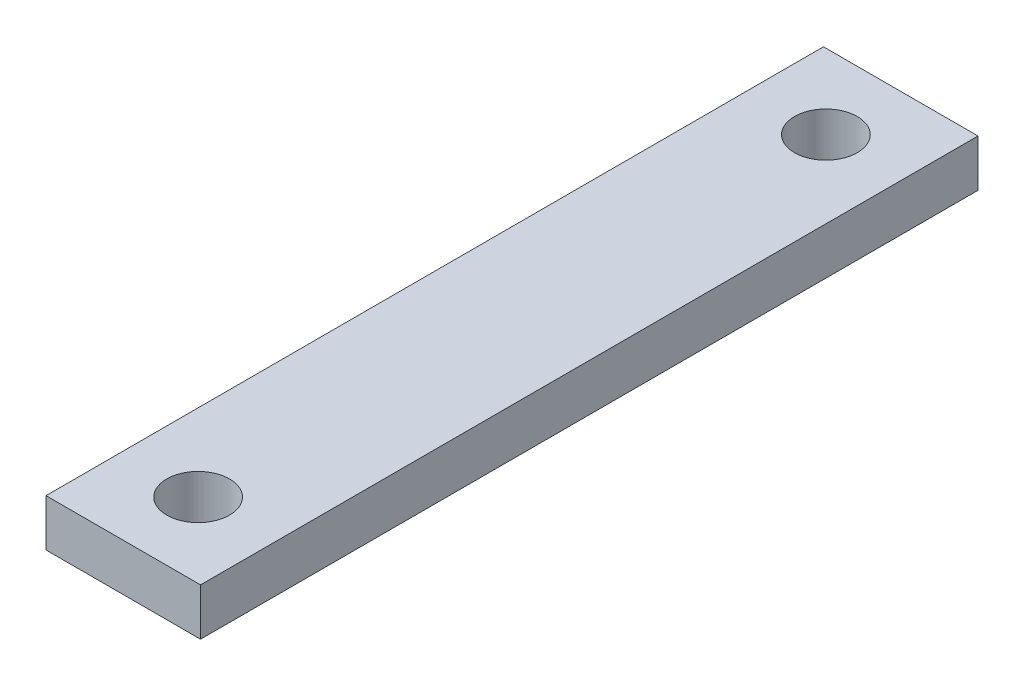
from build123d import *

# Parameters (mm, degrees)
SKETCH1_W           = 9.846153846
SKETCH1_H           = 49.538461538
SKETCH1_R           = 2
BOSS_EXTRUDE1_DEPTH = 3


with BuildPart() as part:
    # Sketch1 → Boss-Extrude1 (new body)
    with BuildSketch(Plane(origin=(0, 0, 0), x_dir=(1, 0, 0), z_dir=(0, 1, 0))):
        Rectangle(SKETCH1_W, SKETCH1_H)
        with Locations(Location((0, 20, 0), (0, 0, 270))):
            Circle(SKETCH1_R, mode=Mode.SUBTRACT)
        with Locations(Location((0, -20, 0), (0, 0, 270))):
            Circle(SKETCH1_R, mode=Mode.SUBTRACT)
    extrude(amount=BOSS_EXTRUDE1_DEPTH)


solid = part.part
